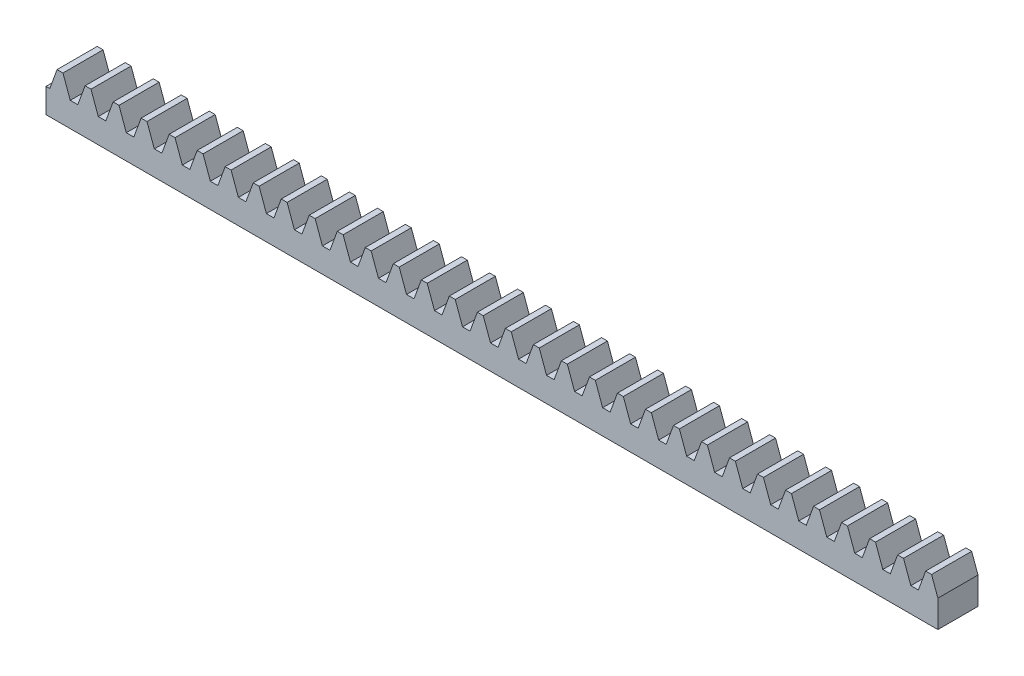
from build123d import *

# Parameters (mm, degrees)
BLANKSKE_W        = 1000
BLANKSKE_H        = 50
BLANK_DEPTH       = 45
TOOTHCUTSIM_DEPTH = 1003.259946321
TEETHCUTS_COUNT   = 33
TEETHCUTS_PITCH   = 31.4159265


with BuildPart() as part:
    # BlankSke → Blank (new body)
    with BuildSketch(Plane.XY):
        with Locations((500, 25)):
            Rectangle(BLANKSKE_W, BLANKSKE_H)
    extrude(amount=-BLANK_DEPTH)

    # TooCutSkeSim → ToothCutSim (cut, through all)
    with BuildSketch(Plane.XY):
        Polygon((4.216353697, 27.5), (-4.216353697, 27.5), (-12.414928812, 50.0254), (12.414928812, 50.0254), align=None)
    toothcutsim = extrude(amount=-TOOTHCUTSIM_DEPTH, mode=Mode.SUBTRACT)

    # TeethCuts: ToothCutSim ×33
    with Locations(*[(i * TEETHCUTS_PITCH, 0, 0) for i in range(1, TEETHCUTS_COUNT)]):
        add(toothcutsim, mode=Mode.SUBTRACT)


solid = part.part
